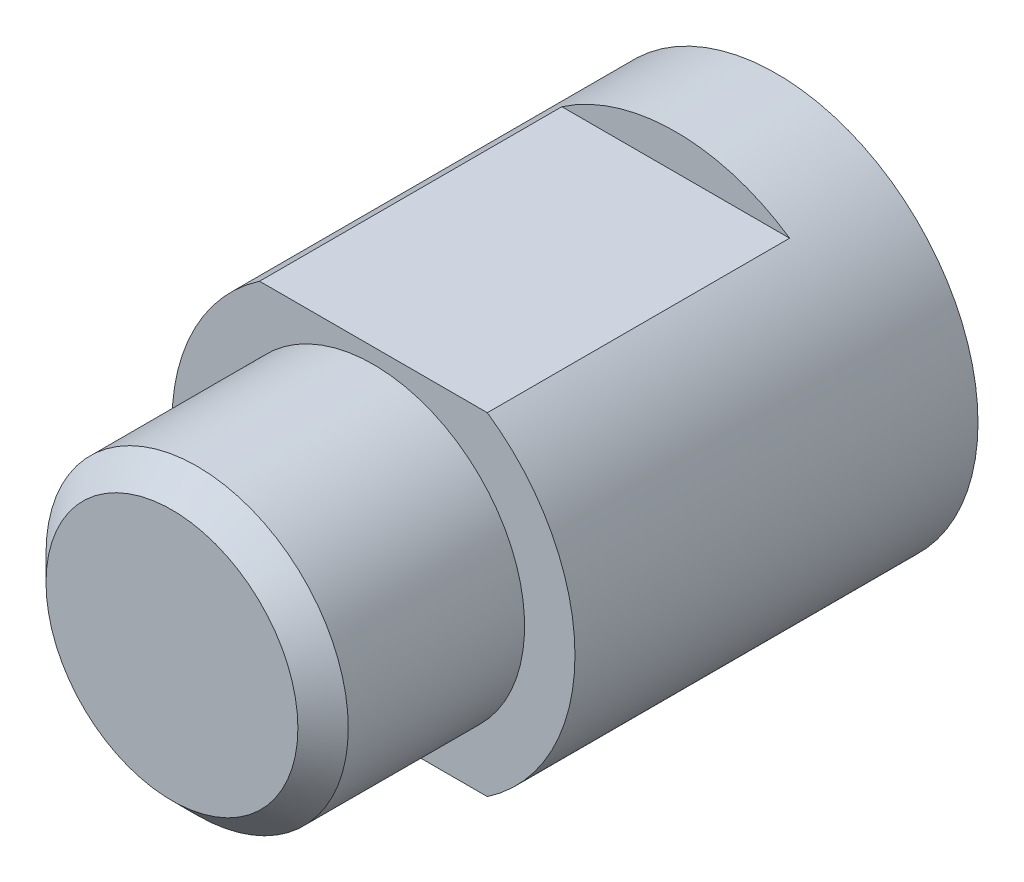
from build123d import *

# Parameters (mm, degrees)
SKETCH_1_R               = 3
EXTRUDE_1_DEPTH          = 4
CHAMFER_1_SIZE           = 0.5
SKETCH_4_R               = 4
EXTRUDE_2_DEPTH          = 8
HOLE_WIZARD_M4_2_D       = 3.3
HOLE_WIZARD_M4_2_DEPTH   = 10.1
HOLE_WIZARD_M4_2_TIP     = 0.991420021
CUT_EXTRUDE_1_DEPTH      = 10.797958971
CUT_EXTRUDE_1_DEPTH_BACK = 10.797958971
SKETCH_7_W               = 6.66597258
SKETCH_7_H               = 2.440047967


with BuildPart() as part:
    # 草图1 → 凸台-拉伸1 (new body)
    with BuildSketch(Plane.XY):
        Circle(SKETCH_1_R)
    extrude(amount=EXTRUDE_1_DEPTH)

    # 倒角1
    chamfer_1_edges = [part.edges().sort_by_distance(p)[0] for p in [
        (-3, 0, 4),
    ]]
    chamfer(chamfer_1_edges, length=CHAMFER_1_SIZE)

    # 草图4 → 凸台-拉伸2 (add)
    with BuildSketch(Plane(origin=(0, 0, 0), x_dir=(-1, 0, 0), z_dir=(0, 0, -1))):
        Circle(SKETCH_4_R)
    extrude(amount=EXTRUDE_2_DEPTH)

    # M4 螺纹孔2
    with Locations(Plane(origin=(0, 0, -8), x_dir=(-1, 0, 0), z_dir=(0, 0, -1))):
        with Locations((0, 0)):
            Hole(HOLE_WIZARD_M4_2_D / 2, depth=HOLE_WIZARD_M4_2_DEPTH)
            with Locations((0, 0, -(HOLE_WIZARD_M4_2_DEPTH + HOLE_WIZARD_M4_2_TIP / 2))):  # 118° drill point
                Cone(0, HOLE_WIZARD_M4_2_D / 2, HOLE_WIZARD_M4_2_TIP, mode=Mode.SUBTRACT)

    # 草图7 → 切除-拉伸1 (cut, two sides: drawn at the far end of the back side and taken through both)
    with BuildSketch(Plane(origin=(0, 0, 0), x_dir=(0, 0, -1), z_dir=(1, 0, 0)).offset(-CUT_EXTRUDE_1_DEPTH_BACK)):
        with Locations((2.66701371, 4.520023984)):
            Rectangle(SKETCH_7_W, SKETCH_7_H)
        with Locations((2.66701371, -4.520023984)):
            Rectangle(SKETCH_7_W, SKETCH_7_H)
    extrude(amount=CUT_EXTRUDE_1_DEPTH + CUT_EXTRUDE_1_DEPTH_BACK, mode=Mode.SUBTRACT)


solid = part.part
